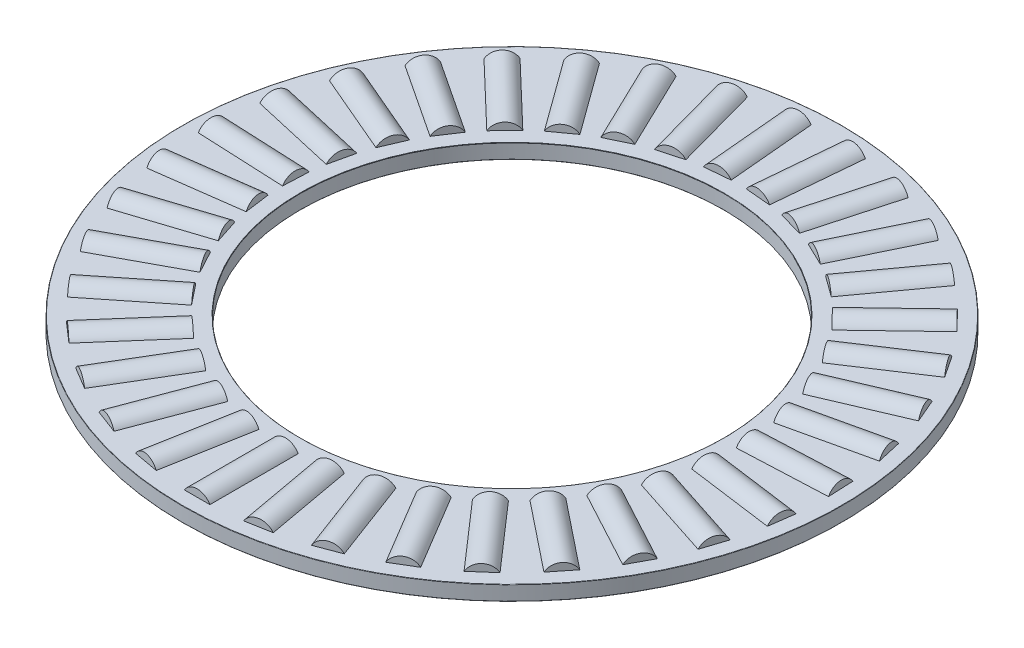
from build123d import *

# Parameters (mm, degrees)
SKETCH1_W         = 7.9375
SKETCH1_H         = 0.9921875
SKETCH3_W         = 5.953125
SKETCH3_H         = 0.9921875
SKETCH2_W         = 5.953125
SKETCH2_H         = 0.9921875
CIRPATTERN1_COUNT = 35
CIRPATTERN1_ANGLE = 349.714285714
CIRPATTERN2_COUNT = 35
FILLET2_R         = 0.01984375


with BuildPart() as part:
    # Sketch1 → Revolve1 (revolve)
    with BuildSketch(Plane(origin=(0, 0, 0), x_dir=(0, 0, -1), z_dir=(1, 0, 0)), mode=Mode.PRIVATE) as revolve1_sk:
        with Locations((-18.25625, 0)):
            Rectangle(SKETCH1_W, SKETCH1_H)
    revolve(revolve1_sk.sketch.rotate(Axis((0, -0.9921875, 0), (0, 1, 0)), 180), axis=Axis((0, -0.9921875, 0), (0, 1, 0)))

    # Sketch3 → Cut-Revolve1 (revolve, cut)
    with BuildSketch(Plane(origin=(0, 0, 0), x_dir=(0, 0, -1), z_dir=(1, 0, 0))):
        with Locations((-18.25625, 0.49609375)):
            Rectangle(SKETCH3_W, SKETCH3_H)
    cut_revolve1 = revolve(axis=Axis((0, 0, 21.2328125), (0, 0, -1)), mode=Mode.SUBTRACT)

    # CirPattern2: Cut-Revolve1 ×35 about axis
    cirpattern2_axis = Axis((0, 0, 0), (0, 1, 0))
    for i in range(1, CIRPATTERN2_COUNT):
        add(cut_revolve1.rotate(cirpattern2_axis, i * 360 / CIRPATTERN2_COUNT), mode=Mode.SUBTRACT)

    # Fillet2
    fillet2_edges = [part.edges().sort_by_distance(p)[0] for p in [
        (0, 0.49609375, 22.225),
        (0, 0.49609375, 14.2875),
        (0, -0.49609375, 14.2875),
        (0, -0.49609375, 22.225),
    ]]
    fillet(fillet2_edges, radius=FILLET2_R)


with BuildPart() as body_2:
    # Sketch2 → Revolve2 (revolve)
    with BuildSketch(Plane(origin=(0, 0, 0), x_dir=(0, 0, -1), z_dir=(1, 0, 0)), mode=Mode.PRIVATE) as revolve2_sk:
        with Locations((-18.25625, 0.49609375)):
            Rectangle(SKETCH2_W, SKETCH2_H)
    revolve(revolve2_sk.sketch.rotate(Axis((0, 0, 21.2328125), (0, 0, -1)), 90), axis=Axis((0, 0, 21.2328125), (0, 0, -1)))


with BuildPart() as cirpattern1_1:
    # CirPattern1: pattern copy
    add(body_2.part.rotate(Axis((0, 0.9921875, 0), (0, -1, 0)), 1 * CIRPATTERN1_ANGLE / (CIRPATTERN1_COUNT - 1)))


with BuildPart() as cirpattern1_2:
    # CirPattern1: pattern copy
    add(body_2.part.rotate(Axis((0, 0.9921875, 0), (0, -1, 0)), 2 * CIRPATTERN1_ANGLE / (CIRPATTERN1_COUNT - 1)))


with BuildPart() as cirpattern1_3:
    # CirPattern1: pattern copy
    add(body_2.part.rotate(Axis((0, 0.9921875, 0), (0, -1, 0)), 3 * CIRPATTERN1_ANGLE / (CIRPATTERN1_COUNT - 1)))


with BuildPart() as cirpattern1_4:
    # CirPattern1: pattern copy
    add(body_2.part.rotate(Axis((0, 0.9921875, 0), (0, -1, 0)), 4 * CIRPATTERN1_ANGLE / (CIRPATTERN1_COUNT - 1)))


with BuildPart() as cirpattern1_5:
    # CirPattern1: pattern copy
    add(body_2.part.rotate(Axis((0, 0.9921875, 0), (0, -1, 0)), 5 * CIRPATTERN1_ANGLE / (CIRPATTERN1_COUNT - 1)))


with BuildPart() as cirpattern1_6:
    # CirPattern1: pattern copy
    add(body_2.part.rotate(Axis((0, 0.9921875, 0), (0, -1, 0)), 6 * CIRPATTERN1_ANGLE / (CIRPATTERN1_COUNT - 1)))


with BuildPart() as cirpattern1_7:
    # CirPattern1: pattern copy
    add(body_2.part.rotate(Axis((0, 0.9921875, 0), (0, -1, 0)), 7 * CIRPATTERN1_ANGLE / (CIRPATTERN1_COUNT - 1)))


with BuildPart() as cirpattern1_8:
    # CirPattern1: pattern copy
    add(body_2.part.rotate(Axis((0, 0.9921875, 0), (0, -1, 0)), 8 * CIRPATTERN1_ANGLE / (CIRPATTERN1_COUNT - 1)))


with BuildPart() as cirpattern1_9:
    # CirPattern1: pattern copy
    add(body_2.part.rotate(Axis((0, 0.9921875, 0), (0, -1, 0)), 9 * CIRPATTERN1_ANGLE / (CIRPATTERN1_COUNT - 1)))


with BuildPart() as cirpattern1_10:
    # CirPattern1: pattern copy
    add(body_2.part.rotate(Axis((0, 0.9921875, 0), (0, -1, 0)), 10 * CIRPATTERN1_ANGLE / (CIRPATTERN1_COUNT - 1)))


with BuildPart() as cirpattern1_11:
    # CirPattern1: pattern copy
    add(body_2.part.rotate(Axis((0, 0.9921875, 0), (0, -1, 0)), 11 * CIRPATTERN1_ANGLE / (CIRPATTERN1_COUNT - 1)))


with BuildPart() as cirpattern1_12:
    # CirPattern1: pattern copy
    add(body_2.part.rotate(Axis((0, 0.9921875, 0), (0, -1, 0)), 12 * CIRPATTERN1_ANGLE / (CIRPATTERN1_COUNT - 1)))


with BuildPart() as cirpattern1_13:
    # CirPattern1: pattern copy
    add(body_2.part.rotate(Axis((0, 0.9921875, 0), (0, -1, 0)), 13 * CIRPATTERN1_ANGLE / (CIRPATTERN1_COUNT - 1)))


with BuildPart() as cirpattern1_14:
    # CirPattern1: pattern copy
    add(body_2.part.rotate(Axis((0, 0.9921875, 0), (0, -1, 0)), 14 * CIRPATTERN1_ANGLE / (CIRPATTERN1_COUNT - 1)))


with BuildPart() as cirpattern1_15:
    # CirPattern1: pattern copy
    add(body_2.part.rotate(Axis((0, 0.9921875, 0), (0, -1, 0)), 15 * CIRPATTERN1_ANGLE / (CIRPATTERN1_COUNT - 1)))


with BuildPart() as cirpattern1_16:
    # CirPattern1: pattern copy
    add(body_2.part.rotate(Axis((0, 0.9921875, 0), (0, -1, 0)), 16 * CIRPATTERN1_ANGLE / (CIRPATTERN1_COUNT - 1)))


with BuildPart() as cirpattern1_17:
    # CirPattern1: pattern copy
    add(body_2.part.rotate(Axis((0, 0.9921875, 0), (0, -1, 0)), 17 * CIRPATTERN1_ANGLE / (CIRPATTERN1_COUNT - 1)))


with BuildPart() as cirpattern1_18:
    # CirPattern1: pattern copy
    add(body_2.part.rotate(Axis((0, 0.9921875, 0), (0, -1, 0)), 18 * CIRPATTERN1_ANGLE / (CIRPATTERN1_COUNT - 1)))


with BuildPart() as cirpattern1_19:
    # CirPattern1: pattern copy
    add(body_2.part.rotate(Axis((0, 0.9921875, 0), (0, -1, 0)), 19 * CIRPATTERN1_ANGLE / (CIRPATTERN1_COUNT - 1)))


with BuildPart() as cirpattern1_20:
    # CirPattern1: pattern copy
    add(body_2.part.rotate(Axis((0, 0.9921875, 0), (0, -1, 0)), 20 * CIRPATTERN1_ANGLE / (CIRPATTERN1_COUNT - 1)))


with BuildPart() as cirpattern1_21:
    # CirPattern1: pattern copy
    add(body_2.part.rotate(Axis((0, 0.9921875, 0), (0, -1, 0)), 21 * CIRPATTERN1_ANGLE / (CIRPATTERN1_COUNT - 1)))


with BuildPart() as cirpattern1_22:
    # CirPattern1: pattern copy
    add(body_2.part.rotate(Axis((0, 0.9921875, 0), (0, -1, 0)), 22 * CIRPATTERN1_ANGLE / (CIRPATTERN1_COUNT - 1)))


with BuildPart() as cirpattern1_23:
    # CirPattern1: pattern copy
    add(body_2.part.rotate(Axis((0, 0.9921875, 0), (0, -1, 0)), 23 * CIRPATTERN1_ANGLE / (CIRPATTERN1_COUNT - 1)))


with BuildPart() as cirpattern1_24:
    # CirPattern1: pattern copy
    add(body_2.part.rotate(Axis((0, 0.9921875, 0), (0, -1, 0)), 24 * CIRPATTERN1_ANGLE / (CIRPATTERN1_COUNT - 1)))


with BuildPart() as cirpattern1_25:
    # CirPattern1: pattern copy
    add(body_2.part.rotate(Axis((0, 0.9921875, 0), (0, -1, 0)), 25 * CIRPATTERN1_ANGLE / (CIRPATTERN1_COUNT - 1)))


with BuildPart() as cirpattern1_26:
    # CirPattern1: pattern copy
    add(body_2.part.rotate(Axis((0, 0.9921875, 0), (0, -1, 0)), 26 * CIRPATTERN1_ANGLE / (CIRPATTERN1_COUNT - 1)))


with BuildPart() as cirpattern1_27:
    # CirPattern1: pattern copy
    add(body_2.part.rotate(Axis((0, 0.9921875, 0), (0, -1, 0)), 27 * CIRPATTERN1_ANGLE / (CIRPATTERN1_COUNT - 1)))


with BuildPart() as cirpattern1_28:
    # CirPattern1: pattern copy
    add(body_2.part.rotate(Axis((0, 0.9921875, 0), (0, -1, 0)), 28 * CIRPATTERN1_ANGLE / (CIRPATTERN1_COUNT - 1)))


with BuildPart() as cirpattern1_29:
    # CirPattern1: pattern copy
    add(body_2.part.rotate(Axis((0, 0.9921875, 0), (0, -1, 0)), 29 * CIRPATTERN1_ANGLE / (CIRPATTERN1_COUNT - 1)))


with BuildPart() as cirpattern1_30:
    # CirPattern1: pattern copy
    add(body_2.part.rotate(Axis((0, 0.9921875, 0), (0, -1, 0)), 30 * CIRPATTERN1_ANGLE / (CIRPATTERN1_COUNT - 1)))


with BuildPart() as cirpattern1_31:
    # CirPattern1: pattern copy
    add(body_2.part.rotate(Axis((0, 0.9921875, 0), (0, -1, 0)), 31 * CIRPATTERN1_ANGLE / (CIRPATTERN1_COUNT - 1)))


with BuildPart() as cirpattern1_32:
    # CirPattern1: pattern copy
    add(body_2.part.rotate(Axis((0, 0.9921875, 0), (0, -1, 0)), 32 * CIRPATTERN1_ANGLE / (CIRPATTERN1_COUNT - 1)))


with BuildPart() as cirpattern1_33:
    # CirPattern1: pattern copy
    add(body_2.part.rotate(Axis((0, 0.9921875, 0), (0, -1, 0)), 33 * CIRPATTERN1_ANGLE / (CIRPATTERN1_COUNT - 1)))


with BuildPart() as cirpattern1_34:
    # CirPattern1: pattern copy
    add(body_2.part.rotate(Axis((0, 0.9921875, 0), (0, -1, 0)), 34 * CIRPATTERN1_ANGLE / (CIRPATTERN1_COUNT - 1)))


solid = Compound([part.part, body_2.part, cirpattern1_1.part, cirpattern1_2.part, cirpattern1_3.part, cirpattern1_4.part, cirpattern1_5.part, cirpattern1_6.part, cirpattern1_7.part, cirpattern1_8.part, cirpattern1_9.part, cirpattern1_10.part, cirpattern1_11.part, cirpattern1_12.part, cirpattern1_13.part, cirpattern1_14.part, cirpattern1_15.part, cirpattern1_16.part, cirpattern1_17.part, cirpattern1_18.part, cirpattern1_19.part, cirpattern1_20.part, cirpattern1_21.part, cirpattern1_22.part, cirpattern1_23.part, cirpattern1_24.part, cirpattern1_25.part, cirpattern1_26.part, cirpattern1_27.part, cirpattern1_28.part, cirpattern1_29.part, cirpattern1_30.part, cirpattern1_31.part, cirpattern1_32.part, cirpattern1_33.part, cirpattern1_34.part])
